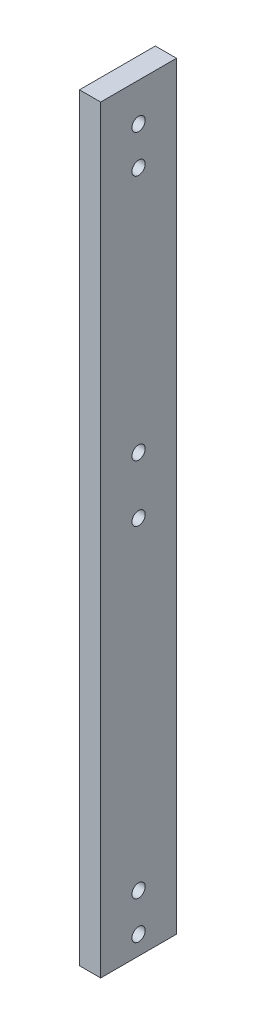
from build123d import *

# Parameters (mm, degrees)
SKETCH1_W           = 20
SKETCH1_H           = 200
BOSS_EXTRUDE1_DEPTH = 5.588
SKETCH2_R           = 1.75
CUT_EXTRUDE1_DEPTH  = 137.824655756
SKETCH3_R           = 1.75
CUT_EXTRUDE2_DEPTH  = 137.824655756


with BuildPart() as part:
    # Sketch1 → Boss-Extrude1 (new body)
    with BuildSketch(Plane(origin=(0, 0, 0), x_dir=(0, 0, -1), z_dir=(1, 0, 0))):
        with Locations((3.257579928, 36.066150284)):
            Rectangle(SKETCH1_W, SKETCH1_H)
    extrude(amount=BOSS_EXTRUDE1_DEPTH)

    # Sketch2 → Cut-Extrude1 (cut, through all)
    with BuildSketch(Plane(origin=(5.588, 0, 0), x_dir=(0, 0, -1), z_dir=(1, 0, 0))):
        with Locations((3.257579928, -58.933849716)):
            Circle(SKETCH2_R)
        with Locations((3.257579928, -48.933849716)):
            Circle(SKETCH2_R)
        with Locations((3.257579928, 116.066150284)):
            Circle(SKETCH2_R)
        with Locations((3.257579928, 126.066150284)):
            Circle(SKETCH2_R)
    extrude(amount=-CUT_EXTRUDE1_DEPTH, mode=Mode.SUBTRACT)

    # Sketch3 → Cut-Extrude2 (cut, through all)
    with BuildSketch(Plane(origin=(5.588, 0, 0), x_dir=(0, 0, -1), z_dir=(1, 0, 0))):
        with Locations((3.257579928, 36.066150284)):
            Circle(SKETCH3_R)
        with Locations((3.257579928, 51.066150284)):
            Circle(SKETCH3_R)
    extrude(amount=-CUT_EXTRUDE2_DEPTH, mode=Mode.SUBTRACT)


solid = part.part
